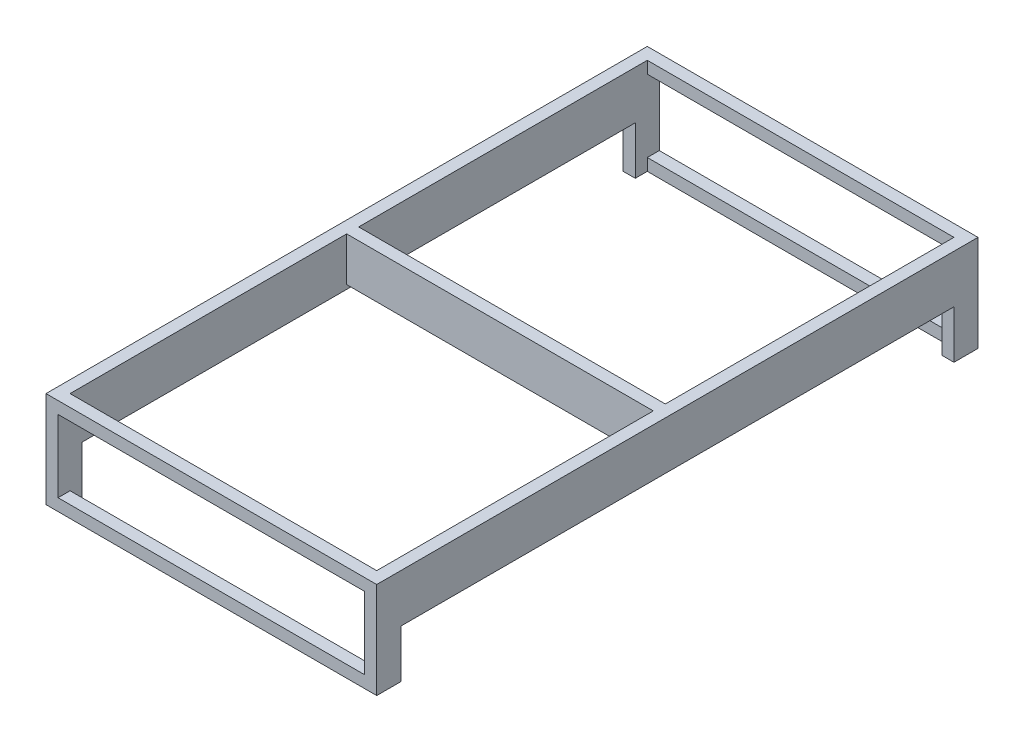
from build123d import *

# Parameters (mm, degrees)
SKETCH1_W           = 550
SKETCH1_H           = 160
SKETCH1_W_2         = 510
SKETCH1_H_2         = 120
BOSS_EXTRUDE1_DEPTH = 1000
SKETCH2_W           = 920
SKETCH2_H           = 80
CUT_EXTRUDE1_DEPTH  = 1000
SKETCH3_W           = 510
SKETCH3_H           = 960
CUT_EXTRUDE3_DEPTH  = 1000
SKETCH4_W           = 550
SKETCH4_H           = 20
BOSS_EXTRUDE2_DEPTH = 73


with BuildPart() as part:
    # Sketch1 → Boss-Extrude1 (new body)
    with BuildSketch(Plane.XY):
        with Locations((255, 60)):
            Rectangle(SKETCH1_W, SKETCH1_H)
        with Locations((255, 60)):
            Rectangle(SKETCH1_W_2, SKETCH1_H_2, mode=Mode.SUBTRACT)
    extrude(amount=BOSS_EXTRUDE1_DEPTH)

    # Sketch2 → Cut-Extrude1 (cut)
    with BuildSketch(Plane.ZY.offset(20)):
        with Locations((500, 20)):
            Rectangle(SKETCH2_W, SKETCH2_H)
    extrude(amount=-CUT_EXTRUDE1_DEPTH, mode=Mode.SUBTRACT)

    # Sketch3 → Cut-Extrude3 (cut)
    with BuildSketch(Plane(origin=(0, 140, 0), x_dir=(1, 0, 0), z_dir=(0, 1, 0))):
        with Locations((255, -500)):
            Rectangle(SKETCH3_W, SKETCH3_H)
    extrude(amount=-CUT_EXTRUDE3_DEPTH, mode=Mode.SUBTRACT)

    # Sketch4 → Boss-Extrude2 (add)
    with BuildSketch(Plane(origin=(0, 140, 0), x_dir=(1, 0, 0), z_dir=(0, 1, 0))):
        with Locations((255, -510)):
            Rectangle(SKETCH4_W, SKETCH4_H)
    extrude(amount=-BOSS_EXTRUDE2_DEPTH)


solid = part.part
